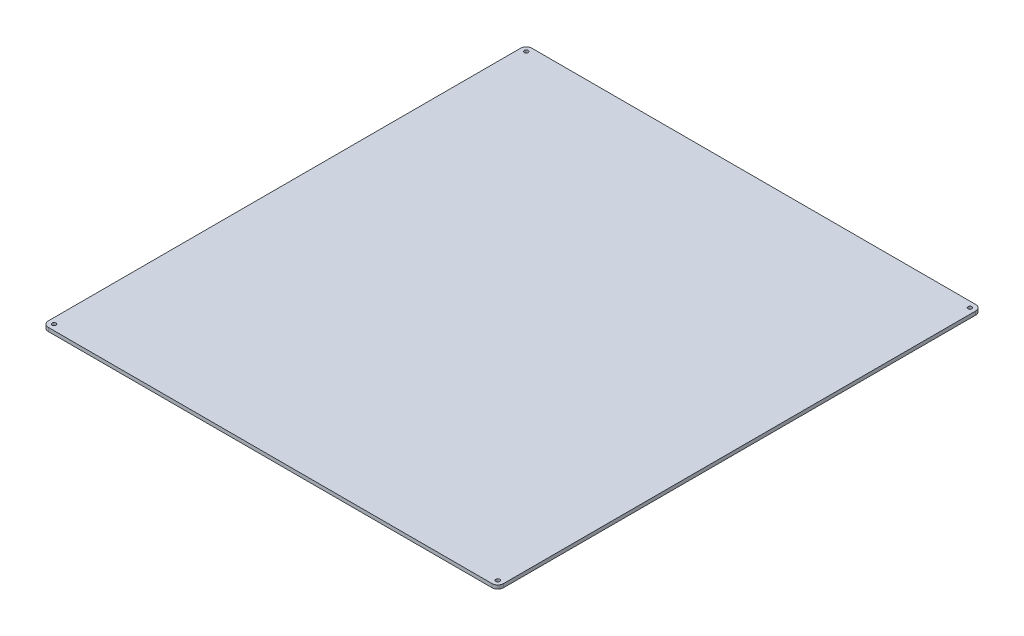
from build123d import *

# Parameters (mm, degrees)
SKETCH2_W            = 400
SKETCH2_H            = 425
BOSS_EXTRUDE1_DEPTH  = 3.175
M3_CLEARANCE_HOLE1_D = 3.4
FILLET1_R            = 5


with BuildPart() as part:
    # Sketch2 → Boss-Extrude1 (new body)
    with BuildSketch(Plane(origin=(0, 0, 0), x_dir=(1, 0, 0), z_dir=(0, 1, 0))):
        with Locations((200, 212.5)):
            Rectangle(SKETCH2_W, SKETCH2_H)
    extrude(amount=BOSS_EXTRUDE1_DEPTH)

    # M3 Clearance Hole1 (through all)
    with Locations(Plane(origin=(5, 3.175, -420), x_dir=(0, 0, 1), z_dir=(0, 1, 0))):
        with Locations((0, 0), (0, 390), (415, 0), (415, 390)):
            Hole(M3_CLEARANCE_HOLE1_D / 2)

    # Fillet1
    fillet1_edges = [part.edges().sort_by_distance(p)[0] for p in [
        (0, 1.5875, -425),
        (400, 1.5875, -425),
        (400, 1.5875, 0),
        (0, 1.5875, 0),
    ]]
    fillet(fillet1_edges, radius=FILLET1_R)


solid = part.part
